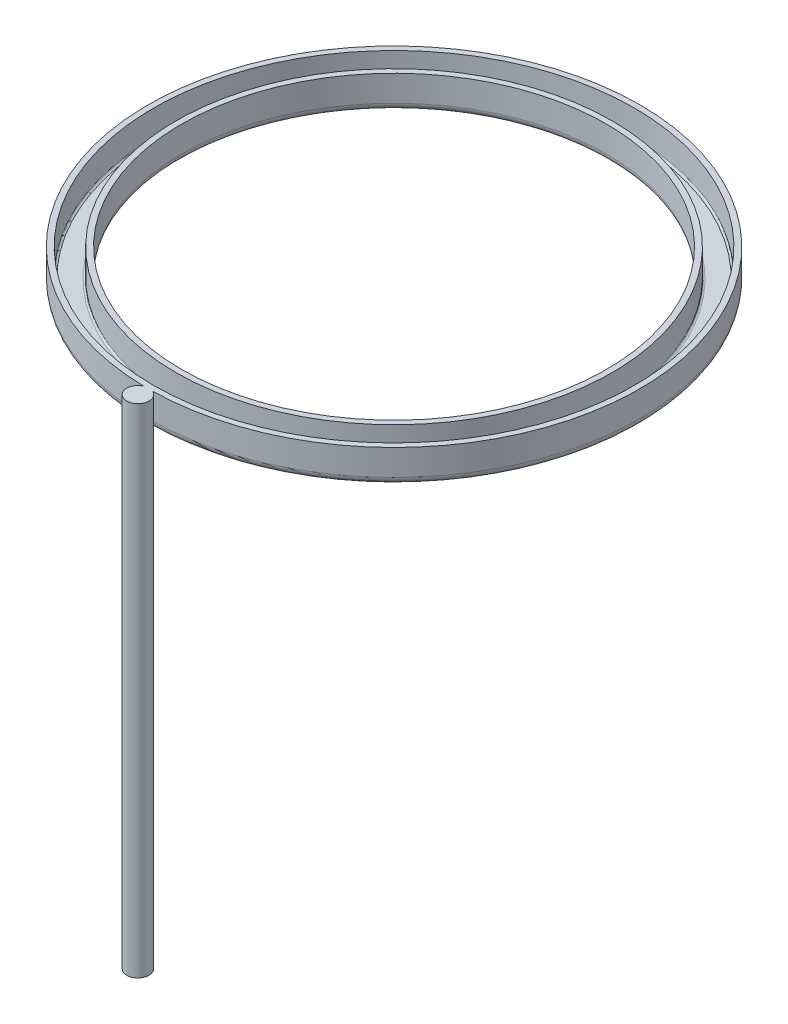
from build123d import *

# Parameters (mm, degrees)
EXTRUDE1_DEPTH      = 0.9
EXTRUDE1_DEPTH_BACK = 12.5
SKETCH3_R           = 0.3


with BuildPart() as part:
    # Sketch1 → Revolve-Thin1 (revolve)
    with BuildSketch(Plane.XY):
        with BuildLine():
            Line((-6.625, 0.9), (-6.625, 0.2))
            ThreePointArc((-6.625, 0.2), (-6.566421356, 0.058578644), (-6.425, 0))
            Line((-6.425, 0), (-5.925, 0))
            ThreePointArc((-5.925, 0), (-5.783578644, 0.058578644), (-5.725, 0.2))
            Line((-5.725, 0.2), (-5.725, 0.9))
            Line((-5.725, 0.9), (-5.875, 0.9))
            Line((-5.875, 0.9), (-5.875, 0.2))
            ThreePointArc((-5.875, 0.2), (-5.889644661, 0.164644661), (-5.925, 0.15))
            Line((-5.925, 0.15), (-6.425, 0.15))
            ThreePointArc((-6.425, 0.15), (-6.460355339, 0.164644661), (-6.475, 0.2))
            Line((-6.475, 0.2), (-6.475, 0.9))
            Line((-6.475, 0.9), (-6.625, 0.9))
        make_face()
    revolve(axis=Axis((0, 22.559206249, 0), (0, -1, 0)))

    # Sketch3 → Extrude1 (add, two sides: drawn at the far end of the back side and taken through both)
    with BuildSketch(Plane(origin=(0, 0, 0), x_dir=(1, 0, 0), z_dir=(0, 1, 0)).offset(-EXTRUDE1_DEPTH_BACK)):
        with Locations((0, -6.9)):
            Circle(SKETCH3_R)
    extrude(amount=EXTRUDE1_DEPTH + EXTRUDE1_DEPTH_BACK)


solid = part.part
